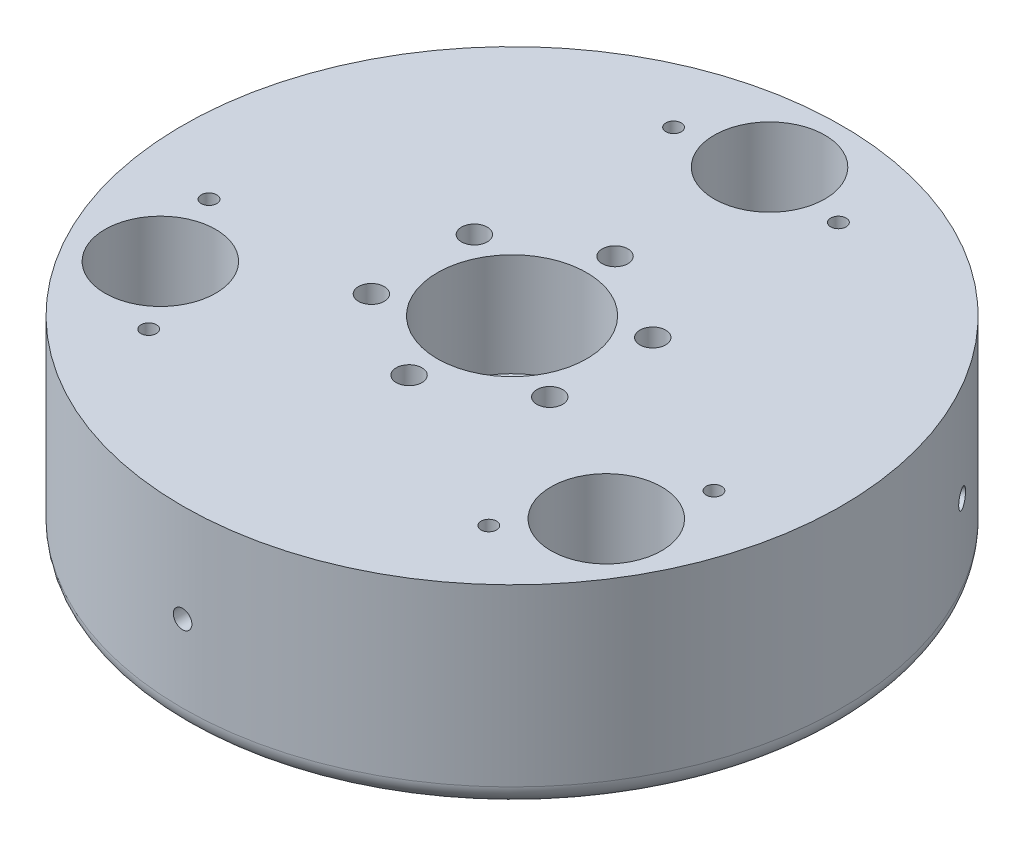
from build123d import *

# Parameters (mm, degrees)
SKETCH_1_R               = 32
SKETCH_1_R_2             = 4
SKETCH_1_R_3             = 3
EXTRUDE_1_DEPTH          = 19
FILLET_1_R               = 2
SKETCH_2_R               = 5.375
CUT_EXTRUDE_1_DEPTH      = 15.5
SKETCH_3_R               = 2.625
CUT_EXTRUDE_2_DEPTH      = 15
SKETCH_4_R               = 1.25
CUT_EXTRUDE_3_DEPTH      = 50.081564832
SKETCH_7_R               = 1.95
CUT_EXTRUDE_5_DEPTH      = 3
CHAMFER_1_SIZE           = 1
SKETCH_8_R               = 7.25
CUT_EXTRUDE_6_DEPTH      = 10
SKETCH_9_R               = 0.75
CUT_EXTRUDE_7_DEPTH      = 50.081564832
CUT_EXTRUDE_9_REACH      = 76.034
CUT_EXTRUDE_9_END_RADIUS = 2.625
SKETCH_11_R              = 0.9
PATTERN_CIRCULAR_7_COUNT = 3


with BuildPart() as part:
    # Эскиз1 → Бобышка-Вытянуть1 (new body)
    with BuildSketch(Plane(origin=(0, 0, 0), x_dir=(1, 0, 0), z_dir=(0, 1, 0))):
        with Locations(Location((0, 0, 0), (0, 0, 270))):
            Circle(SKETCH_1_R)
        with Locations(Location((0, 0, 0), (0, 0, 270))):
            Circle(SKETCH_1_R_2, mode=Mode.SUBTRACT)
        with Locations(Location((0, 25, 0), (0, 0, 270))):
            Circle(SKETCH_1_R_3, mode=Mode.SUBTRACT)
        with Locations(Location((21.650635095, -12.5, 0), (0, 0, 270))):
            Circle(SKETCH_1_R_3, mode=Mode.SUBTRACT)
        with Locations(Location((-21.650635095, -12.5, 0), (0, 0, 270))):
            Circle(SKETCH_1_R_3, mode=Mode.SUBTRACT)
    extrude(amount=EXTRUDE_1_DEPTH)

    # Скругление1
    fillet_1_edges = [part.edges().sort_by_distance(p)[0] for p in [
        (0, 0, -32),
    ]]
    fillet(fillet_1_edges, radius=FILLET_1_R)

    # Эскиз2 → Вырез-Вытянуть1 (cut)
    with BuildSketch(Plane(origin=(0, 19, 0), x_dir=(1, 0, 0), z_dir=(0, 1, 0))):
        with Locations(Location((0, 25, 0), (0, 0, 270))):
            Circle(SKETCH_2_R)
        with Locations(Location((21.650635095, -12.5, 0), (0, 0, 270))):
            Circle(SKETCH_2_R)
        with Locations(Location((-21.650635095, -12.5, 0), (0, 0, 270))):
            Circle(SKETCH_2_R)
    extrude(amount=-CUT_EXTRUDE_1_DEPTH, mode=Mode.SUBTRACT)

    # Эскиз3 → Вырез-Вытянуть2 (cut)
    with BuildSketch(Plane.XZ):
        with Locations(Location((0, 25, 0), (0, 0, 270))):
            Circle(SKETCH_3_R)
        with Locations(Location((21.650635095, -12.5, 0), (0, 0, 270))):
            Circle(SKETCH_3_R)
        with Locations(Location((-21.650635095, -12.5, 0), (0, 0, 270))):
            Circle(SKETCH_3_R)
    extrude(amount=-CUT_EXTRUDE_2_DEPTH, mode=Mode.SUBTRACT)

    # Эскиз4 → Вырез-Вытянуть3 (cut, through all)
    with BuildSketch(Plane(origin=(0, 19, 0), x_dir=(1, 0, 0), z_dir=(0, 1, 0))):
        with Locations(Location((0, 10, 0), (0, 0, 270))):
            Circle(SKETCH_4_R)
        with Locations(Location((8.660254038, 5, 0), (0, 0, 270))):
            Circle(SKETCH_4_R)
        with Locations(Location((8.660254038, -5, 0), (0, 0, 270))):
            Circle(SKETCH_4_R)
        with Locations(Location((0, -10, 0), (0, 0, 270))):
            Circle(SKETCH_4_R)
        with Locations(Location((-8.660254038, -5, 0), (0, 0, 270))):
            Circle(SKETCH_4_R)
        with Locations(Location((-8.660254038, 5, 0), (0, 0, 270))):
            Circle(SKETCH_4_R)
    extrude(amount=-CUT_EXTRUDE_3_DEPTH, mode=Mode.SUBTRACT)

    # Эскиз7 → Вырез-Вытянуть5 (cut)
    with BuildSketch(Plane.XZ):
        with Locations(Location((8.660254038, 5, 0), (0, 0, 270))):
            Circle(SKETCH_7_R)
        with Locations(Location((0, -10, 0), (0, 0, 270))):
            Circle(SKETCH_7_R)
        with Locations(Location((-8.660254038, 5, 0), (0, 0, 270))):
            Circle(SKETCH_7_R)
    extrude(amount=-CUT_EXTRUDE_5_DEPTH, mode=Mode.SUBTRACT)

    # Фаска1
    chamfer_1_edges = [part.edges().sort_by_distance(p)[0] for p in [
        (21.650635095, 0, 9.5),
        (-21.650635095, 0, 9.5),
        (0, 0, 27.625),
        (21.650635095, 0, -9.875),
        (-21.650635095, 0, -9.875),
        (0, 0, -4),
        (0, 0, -28),
    ]]
    chamfer(chamfer_1_edges, length=CHAMFER_1_SIZE)

    # Эскиз8 → Вырез-Вытянуть6 (cut)
    with BuildSketch(Plane(origin=(0, 19, 0), x_dir=(1, 0, 0), z_dir=(0, 1, 0))):
        with Locations(Location((0, 0, 0), (0, 0, 270))):
            Circle(SKETCH_8_R)
    extrude(amount=-CUT_EXTRUDE_6_DEPTH, mode=Mode.SUBTRACT)

    # Эскиз9 → Вырез-Вытянуть7 (cut, through all)
    with BuildSketch(Plane(origin=(0, 19, 0), x_dir=(1, 0, 0), z_dir=(0, 1, 0))):
        with Locations(Location((-8, 23.685438565, 0), (0, 0, 270))):
            Circle(SKETCH_9_R)
        with Locations(Location((8, 23.685438565, 0), (0, 0, 270))):
            Circle(SKETCH_9_R)
        with Locations(Location((16.512191497, -18.770922513, 0), (0, 0, 270))):
            Circle(SKETCH_9_R)
        with Locations(Location((24.512191497, -4.914516052, 0), (0, 0, 270))):
            Circle(SKETCH_9_R)
        with Locations(Location((-24.512191497, -4.914516052, 0), (0, 0, 270))):
            Circle(SKETCH_9_R)
        with Locations(Location((-16.512191497, -18.770922513, 0), (0, 0, 270))):
            Circle(SKETCH_9_R)
    extrude(amount=-CUT_EXTRUDE_7_DEPTH, mode=Mode.SUBTRACT)

    # Вырез-Вытянуть9: up to this cylinder (the profile starts outside it)
    cut_extrude_9_end = Plane(origin=(0, 9.5, 25), z_dir=(0, -1, 0)) * Cylinder(CUT_EXTRUDE_9_END_RADIUS, 158.318, mode=Mode.PRIVATE)
    # Эскиз11 → Вырез-Вытянуть9 (cut, up to the surface)
    with BuildSketch(Plane.XY.offset(32), mode=Mode.PRIVATE) as cut_extrude_9_sk1:
        with Locations((0, 9.5)):
            Circle(SKETCH_11_R)
    cut_extrude_9_tool1 = extrude(cut_extrude_9_sk1.sketch, amount=-CUT_EXTRUDE_9_REACH, mode=Mode.PRIVATE) - cut_extrude_9_end
    cut_extrude_9 = cut_extrude_9_tool1.solids().sort_by_distance((0, 9.5, 32))[0]
    add(cut_extrude_9, mode=Mode.SUBTRACT)

    # Круговой массив7: Вырез-Вытянуть9 ×3 about axis
    pattern_circular_7_axis = Axis((0, 19, 0), (0, -1, 0))
    for i in range(1, PATTERN_CIRCULAR_7_COUNT):
        add(cut_extrude_9.rotate(pattern_circular_7_axis, i * 360 / PATTERN_CIRCULAR_7_COUNT), mode=Mode.SUBTRACT)


solid = part.part
